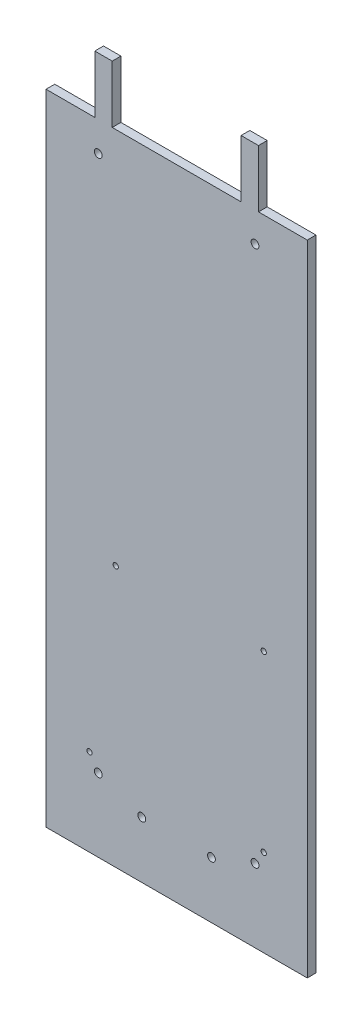
from build123d import *

# Parameters (mm, degrees)
SKETCH_1_R      = 2.25
SKETCH_1_R_2    = 1.5
EXTRUDE_1_DEPTH = 5


with BuildPart() as part:
    # 草图1 → 凸台-拉伸1 (new body)
    with BuildSketch(Plane.XY):
        Polygon((0, 0), (150, 0), (150, 367), (122, 367), (122, 400), (112, 400), (112, 367), (75, 367), (38, 367), (38, 400), (28, 400), (28, 367), (0, 367), align=None)
        with Locations((30, 42)):
            Circle(SKETCH_1_R, mode=Mode.SUBTRACT)
        with Locations((120, 42)):
            Circle(SKETCH_1_R, mode=Mode.SUBTRACT)
        with Locations((30, 350)):
            Circle(SKETCH_1_R, mode=Mode.SUBTRACT)
        with Locations((120, 350)):
            Circle(SKETCH_1_R, mode=Mode.SUBTRACT)
        with Locations((25, 50)):
            Circle(SKETCH_1_R_2, mode=Mode.SUBTRACT)
        with Locations((125, 50)):
            Circle(SKETCH_1_R_2, mode=Mode.SUBTRACT)
        with Locations((40, 150)):
            Circle(SKETCH_1_R_2, mode=Mode.SUBTRACT)
        with Locations((125, 150)):
            Circle(SKETCH_1_R_2, mode=Mode.SUBTRACT)
        with Locations((55, 32.5)):
            Circle(SKETCH_1_R, mode=Mode.SUBTRACT)
        with Locations((95, 32.5)):
            Circle(SKETCH_1_R, mode=Mode.SUBTRACT)
    extrude(amount=EXTRUDE_1_DEPTH)


solid = part.part
